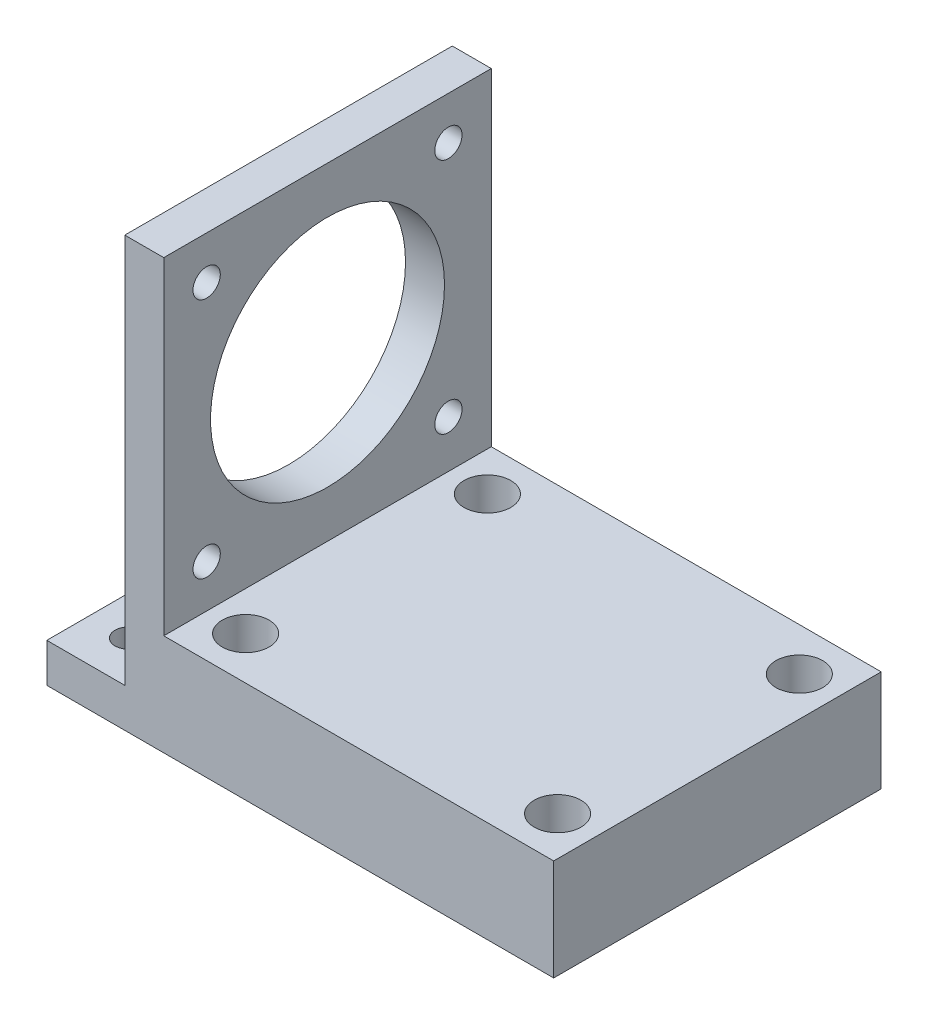
from build123d import *

# Parameters (mm, degrees)
ESBO_O1_W                = 65
ESBO_O1_H                = 42
RESSALTO_EXTRUS_O1_DEPTH = 55
ESBO_O2_W                = 42
ESBO_O2_H                = 50
CORTE_EXTRUS_O1_DEPTH    = 10
ESBO_O3_W                = 42
ESBO_O3_H                = 42
CORTE_EXTRUS_O2_DEPTH    = 50
ESBO_O4_R                = 1.75
CORTE_EXTRUS_O3_DEPTH    = 78.239886069
ESBO_O5_R                = 1.75
CORTE_EXTRUS_O4_DEPTH    = 64.223808806
ESBO_O6_R                = 1.75
CORTE_EXTRUS_O5_DEPTH    = 58.107355043
ESBO_O7_R                = 3
CORTE_EXTRUS_O6_DEPTH    = 8
ESBO_O8_R                = 15
CORTE_EXTRUS_O7_DEPTH    = 78.239886069


with BuildPart() as part:
    # Esboço1 → Ressalto-extrusão1 (new body)
    with BuildSketch(Plane(origin=(0, 0, 0), x_dir=(1, 0, 0), z_dir=(0, 1, 0))):
        Rectangle(ESBO_O1_W, ESBO_O1_H)
    extrude(amount=RESSALTO_EXTRUS_O1_DEPTH)

    # Esboço2 → Corte-extrusão1 (cut)
    with BuildSketch(Plane.ZY.offset(32.5)):
        with Locations((0, 30)):
            Rectangle(ESBO_O2_W, ESBO_O2_H)
    extrude(amount=-CORTE_EXTRUS_O1_DEPTH, mode=Mode.SUBTRACT)

    # Esboço3 → Corte-extrusão2 (cut)
    with BuildSketch(Plane(origin=(32.5, 0, 0), x_dir=(0, 0, -1), z_dir=(1, 0, 0))):
        with Locations((0, 34)):
            Rectangle(ESBO_O3_W, ESBO_O3_H)
    extrude(amount=-CORTE_EXTRUS_O2_DEPTH, mode=Mode.SUBTRACT)

    # Esboço4 → Corte-extrusão3 (cut, through all)
    with BuildSketch(Plane(origin=(-17.5, 0, 0), x_dir=(0, 0, -1), z_dir=(1, 0, 0))):
        with Locations((-15.5, 49.5)):
            Circle(ESBO_O4_R)
        with Locations((15.5, 49.5)):
            Circle(ESBO_O4_R)
        with Locations((15.5, 19.070664067)):
            Circle(ESBO_O4_R)
        with Locations((-15.5, 18.5)):
            Circle(ESBO_O4_R)
    extrude(amount=-CORTE_EXTRUS_O3_DEPTH, mode=Mode.SUBTRACT)

    # Esboço5 → Corte-extrusão4 (cut, through all)
    with BuildSketch(Plane(origin=(0, 5, 0), x_dir=(1, 0, 0), z_dir=(0, 1, 0))):
        with Locations(Location((-27.5, 15.5, 0), (0, 0, 270))):
            Circle(ESBO_O5_R)
        with Locations(Location((-27.5, -15.5, 0), (0, 0, 270))):
            Circle(ESBO_O5_R)
    extrude(amount=-CORTE_EXTRUS_O4_DEPTH, mode=Mode.SUBTRACT)

    # Esboço6 → Corte-extrusão5 (cut, through all)
    with BuildSketch(Plane(origin=(0, 13, 0), x_dir=(1, 0, 0), z_dir=(0, 1, 0))):
        with Locations(Location((-12.5, 15.5, 0), (0, 0, 270))):
            Circle(ESBO_O6_R)
        with Locations(Location((27.5, 15.5, 0), (0, 0, 270))):
            Circle(ESBO_O6_R)
        with Locations(Location((27.5, -15.5, 0), (0, 0, 270))):
            Circle(ESBO_O6_R)
        with Locations(Location((-12.5, -15.5, 0), (0, 0, 270))):
            Circle(ESBO_O6_R)
    extrude(amount=-CORTE_EXTRUS_O5_DEPTH, mode=Mode.SUBTRACT)

    # Esboço7 → Corte-extrusão6 (cut)
    with BuildSketch(Plane(origin=(0, 13, 0), x_dir=(1, 0, 0), z_dir=(0, 1, 0))):
        with Locations(Location((-12.5, 15.5, 0), (0, 0, 270))):
            Circle(ESBO_O7_R)
        with Locations(Location((27.5, 15.5, 0), (0, 0, 270))):
            Circle(ESBO_O7_R)
        with Locations(Location((27.5, -15.5, 0), (0, 0, 270))):
            Circle(ESBO_O7_R)
        with Locations(Location((-12.5, -15.5, 0), (0, 0, 270))):
            Circle(ESBO_O7_R)
    extrude(amount=-CORTE_EXTRUS_O6_DEPTH, mode=Mode.SUBTRACT)

    # Esboço8 → Corte-extrusão7 (cut, through all)
    with BuildSketch(Plane(origin=(-17.5, 0, 0), x_dir=(0, 0, -1), z_dir=(1, 0, 0))):
        with Locations((0, 34)):
            Circle(ESBO_O8_R)
    extrude(amount=-CORTE_EXTRUS_O7_DEPTH, mode=Mode.SUBTRACT)


solid = part.part
